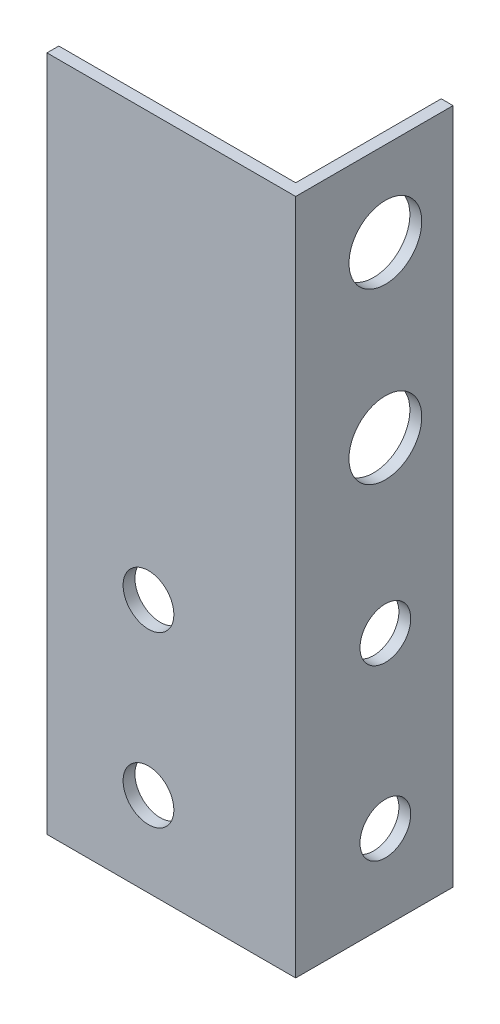
from build123d import *

# Parameters (mm, degrees)
BOSS_EXTRUDE1_DEPTH = 40
SKETCH2_R           = 2.15
SKETCH2_R_2         = 1.5
CUT_EXTRUDE1_DEPTH  = 44.618574025
SKETCH3_R           = 1.5
CUT_EXTRUDE2_DEPTH  = 44.618574025


with BuildPart() as part:
    # Sketch1 → Boss-Extrude1 (new body)
    with BuildSketch(Plane(origin=(0, 0, 0), x_dir=(1, 0, 0), z_dir=(0, 1, 0))):
        Polygon((0, 0), (0, 0.7), (14, 0.7), (14, 9.3), (14.7, 9.3), (14.7, 0), align=None)
    extrude(amount=BOSS_EXTRUDE1_DEPTH)

    # Sketch2 → Cut-Extrude1 (cut, through all)
    with BuildSketch(Plane(origin=(14.7, 0, 0), x_dir=(0, 0, -1), z_dir=(1, 0, 0))):
        with Locations((5.3, 35)):
            Circle(SKETCH2_R)
        with Locations((5.3, 25)):
            Circle(SKETCH2_R)
        with Locations((5.3, 15)):
            Circle(SKETCH2_R_2)
        with Locations((5.3, 5)):
            Circle(SKETCH2_R_2)
    extrude(amount=-CUT_EXTRUDE1_DEPTH, mode=Mode.SUBTRACT)

    # Sketch3 → Cut-Extrude2 (cut, through all)
    with BuildSketch(Plane.XY):
        with Locations((6, 15.001223109)):
            Circle(SKETCH3_R)
        with Locations((6, 5)):
            Circle(SKETCH3_R)
    extrude(amount=-CUT_EXTRUDE2_DEPTH, mode=Mode.SUBTRACT)


solid = part.part
